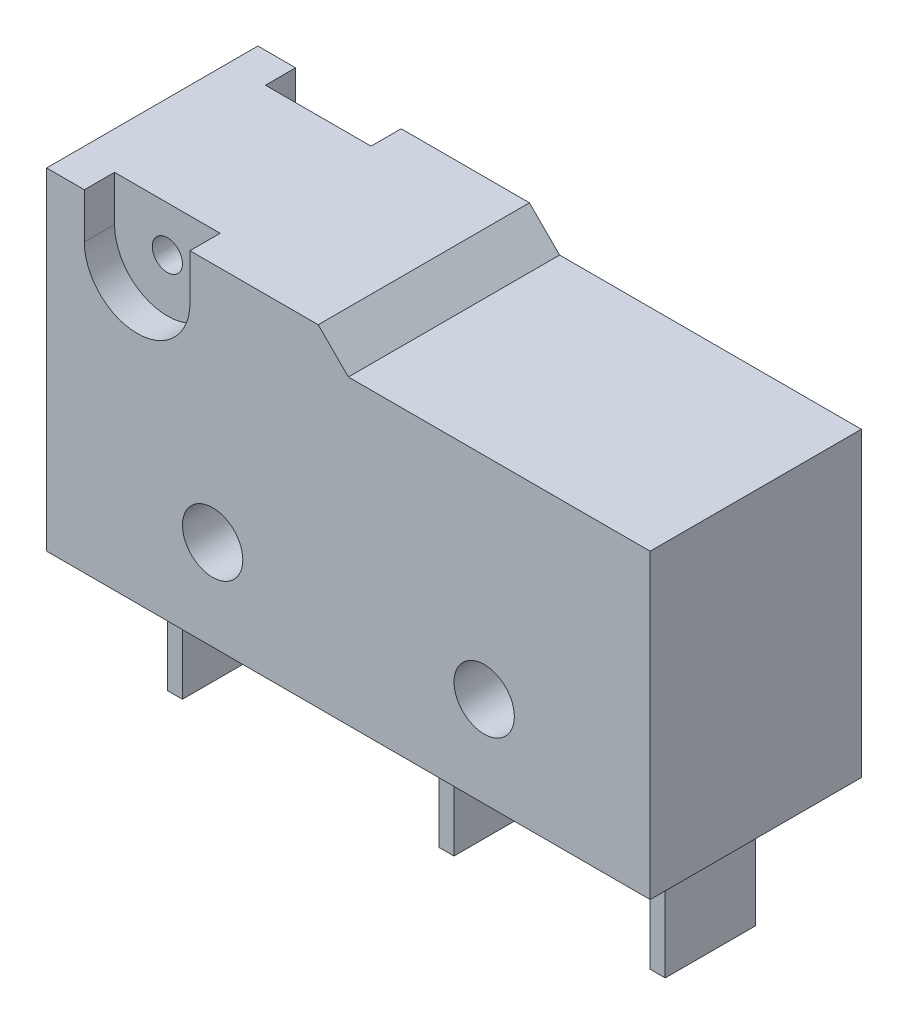
from build123d import *

# Parameters (mm, degrees)
ESQUISSE1_R             = 0.5
ESQUISSE1_R_2           = 1
BOSS_EXTRU_1_DEPTH      = 3.5
ESQUISSE2_W             = 0.5
ESQUISSE2_H             = 3
BOSS_EXTRU_2_DEPTH      = 4
BOSS_EXTRU_2_2_DEPTH    = 4
BOSS_EXTRU_2_3_DEPTH    = 4
ENL_V_MAT_EXTRU_1_DEPTH = 1


with BuildPart() as part:
    # Esquisse1 → Boss.-Extru.1 (new, symmetric)
    with BuildSketch(Plane.XY):
        Polygon((0, 0), (20, 0), (20, 10), (10, 10), (9, 11), (0, 11), align=None)
        with Locations((3, 9.5)):
            Circle(ESQUISSE1_R, mode=Mode.SUBTRACT)
        with Locations((5.5, 3)):
            Circle(ESQUISSE1_R_2, mode=Mode.SUBTRACT)
        with Locations((14.5, 3)):
            Circle(ESQUISSE1_R_2, mode=Mode.SUBTRACT)
    extrude(amount=BOSS_EXTRU_1_DEPTH, both=True)

    # Esquisse3 → Enlèv. mat.-Extru.1 (cut)
    with BuildSketch(Plane.XY.offset(3.5)):
        with BuildLine():
            Line((1.25, 9.5), (1.25, 11))
            ThreePointArc((1.25, 11), (3, 12.75), (4.75, 11))
            Line((4.75, 11), (4.75, 9.5))
            ThreePointArc((4.75, 9.5), (3, 7.75), (1.25, 9.5))
        make_face()
    enl_v_mat_extru_1 = extrude(amount=-ENL_V_MAT_EXTRU_1_DEPTH, mode=Mode.SUBTRACT)

    # Symétrie1: Enlèv. mat.-Extru.1 across plane
    add(enl_v_mat_extru_1.mirror(Plane.XY), mode=Mode.SUBTRACT)


with BuildPart() as body_2:
    # Esquisse2 → Boss.-Extru.2 (new body)
    with BuildSketch(Plane.XZ):
        with Locations((2.25, 0)):
            Rectangle(ESQUISSE2_W, ESQUISSE2_H)
    extrude(amount=BOSS_EXTRU_2_DEPTH)


with BuildPart() as body_3:
    # Esquisse2 → Boss.-Extru.2 2 (new body)
    with BuildSketch(Plane.XZ):
        with Locations((11.25, 0)):
            Rectangle(ESQUISSE2_W, ESQUISSE2_H)
    extrude(amount=BOSS_EXTRU_2_2_DEPTH)


with BuildPart() as body_4:
    # Esquisse2 → Boss.-Extru.2 3 (new body)
    with BuildSketch(Plane.XZ):
        with Locations((18.25, 0)):
            Rectangle(ESQUISSE2_W, ESQUISSE2_H)
    extrude(amount=BOSS_EXTRU_2_3_DEPTH)


solid = Compound([part.part, body_2.part, body_3.part, body_4.part])
